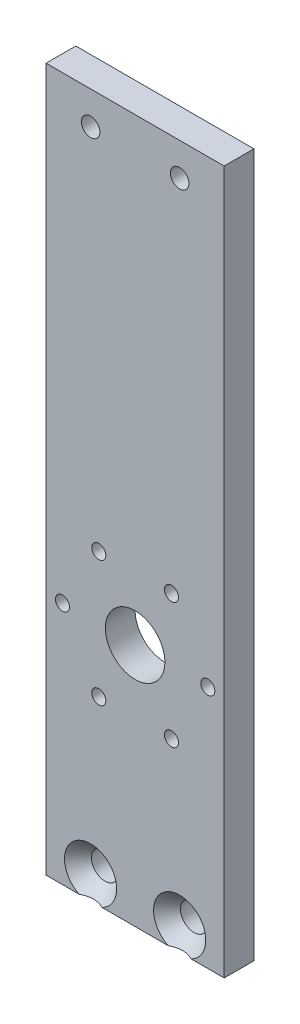
from build123d import *

# Parameters (mm, degrees)
CROQUIS1_W                                           = 38
CROQUIS1_H                                           = 150
SALIENTE_EXTRUIR1_DEPTH                              = 3.175
CROQUIS3_R                                           = 6.35
CROQUIS3_R_2                                         = 1.5
CORTAR_EXTRUIR2_DEPTH                                = 25.4
AVELLANADO_PARA_TORNILLO_CON_CABEZA_OVAL_D           = 5.7912
AVELLANADO_PARA_TORNILLO_CON_CABEZA_OVAL_DEPTH       = 20
AVELLANADO_PARA_TORNILLO_CON_CABEZA_OVAL_CSINK_D     = 11.1252
AVELLANADO_PARA_TORNILLO_CON_CABEZA_OVAL_CSINK_ANGLE = 82
AVELLANADO_PARA_TORNILLO_CON_CABEZA_OVAL_TIP         = 1.739852008
CROQUIS7_R                                           = 1.984375
CORTAR_EXTRUIR3_DEPTH                                = 25.4


with BuildPart() as part:
    # Croquis1 → Saliente-Extruir1 (new, symmetric)
    with BuildSketch(Plane.XY):
        Rectangle(CROQUIS1_W, CROQUIS1_H)
    extrude(amount=SALIENTE_EXTRUIR1_DEPTH, both=True)

    # Croquis3 → Cortar-Extruir2 (cut)
    with BuildSketch(Plane.XY.offset(3.175)):
        with Locations((0, -23)):
            Circle(CROQUIS3_R)
        with Locations((-15.5, -23)):
            Circle(CROQUIS3_R_2)
        with Locations((-7.75, -9.576606241)):
            Circle(CROQUIS3_R_2)
        with Locations((7.75, -9.576606241)):
            Circle(CROQUIS3_R_2)
        with Locations((15.5, -23)):
            Circle(CROQUIS3_R_2)
        with Locations((7.75, -36.423393759)):
            Circle(CROQUIS3_R_2)
        with Locations((-7.75, -36.423393759)):
            Circle(CROQUIS3_R_2)
    extrude(amount=-CORTAR_EXTRUIR2_DEPTH, mode=Mode.SUBTRACT)

    # Avellanado para tornillo con cabeza ovalada de #121
    with Locations(Plane(origin=(-9.5, -70, 3.175), x_dir=(1, 0, 0), z_dir=(0, 0, 1))):
        with Locations((0, 0), (19, 0)):
            CounterSinkHole(AVELLANADO_PARA_TORNILLO_CON_CABEZA_OVAL_D / 2, AVELLANADO_PARA_TORNILLO_CON_CABEZA_OVAL_CSINK_D / 2, depth=AVELLANADO_PARA_TORNILLO_CON_CABEZA_OVAL_DEPTH, counter_sink_angle=AVELLANADO_PARA_TORNILLO_CON_CABEZA_OVAL_CSINK_ANGLE)
            with Locations((0, 0, -(AVELLANADO_PARA_TORNILLO_CON_CABEZA_OVAL_DEPTH + AVELLANADO_PARA_TORNILLO_CON_CABEZA_OVAL_TIP / 2))):  # 118° drill point
                Cone(0, AVELLANADO_PARA_TORNILLO_CON_CABEZA_OVAL_D / 2, AVELLANADO_PARA_TORNILLO_CON_CABEZA_OVAL_TIP, mode=Mode.SUBTRACT)

    # Croquis7 → Cortar-Extruir3 (cut)
    with BuildSketch(Plane.XY.offset(3.175)):
        with Locations((9.5, 68)):
            Circle(CROQUIS7_R)
        with Locations((-9.5, 68)):
            Circle(CROQUIS7_R)
    extrude(amount=-CORTAR_EXTRUIR3_DEPTH, mode=Mode.SUBTRACT)


solid = part.part
